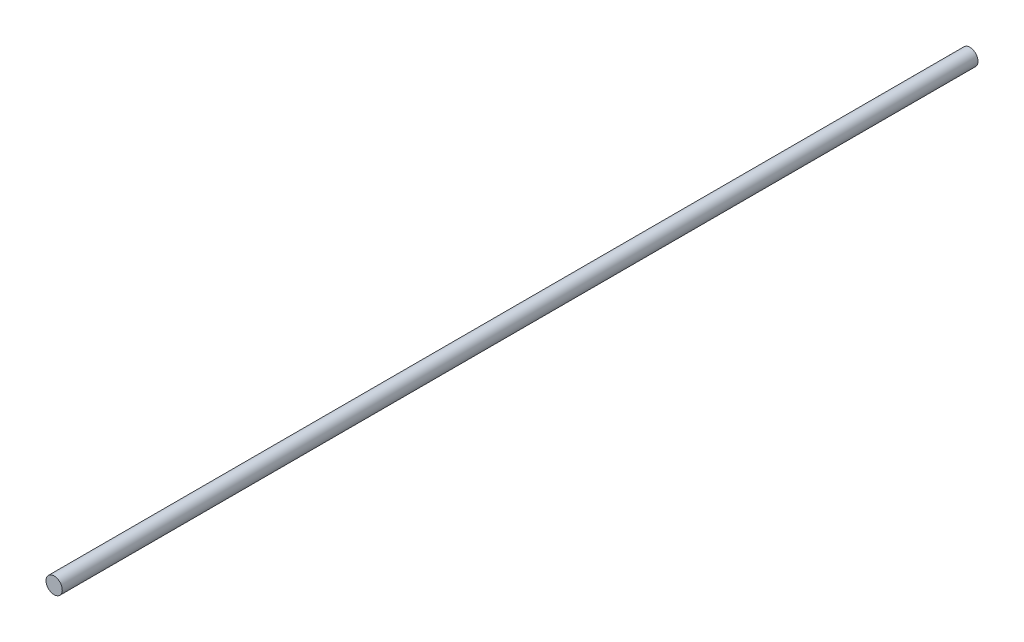
from build123d import *

# Parameters (mm, degrees)
CROQUIS1_R              = 4
SALIENTE_EXTRUIR1_DEPTH = 450


with BuildPart() as part:
    # Croquis1 → Saliente-Extruir1 (new body)
    with BuildSketch(Plane.XY):
        Circle(CROQUIS1_R)
    extrude(amount=SALIENTE_EXTRUIR1_DEPTH)


solid = part.part
